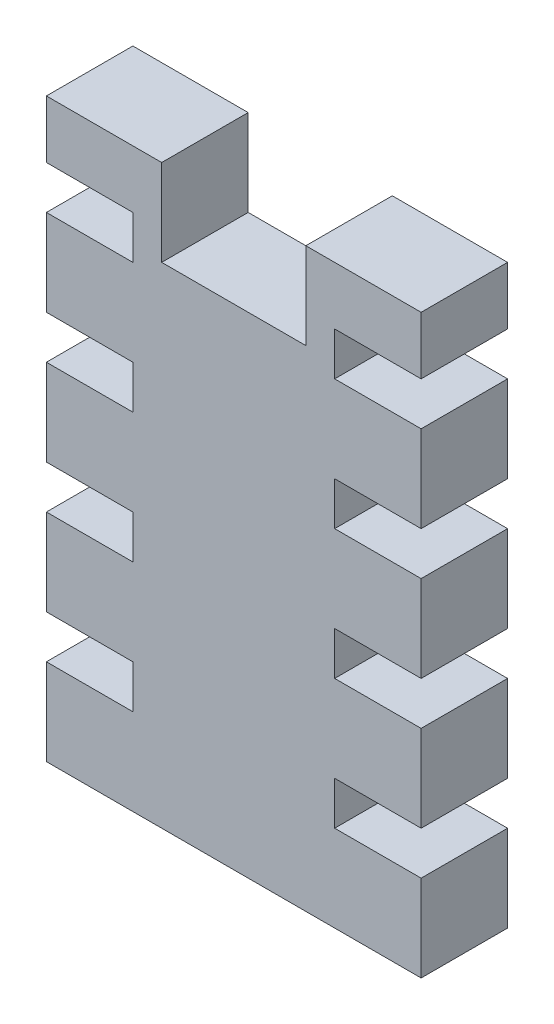
from build123d import *

# Parameters (mm, degrees)
SKETCH1_W           = 13
SKETCH1_H           = 20
BOSS_EXTRUDE1_DEPTH = 3
SKETCH2_W           = 3
SKETCH2_H           = 1.5
CUT_EXTRUDE1_DEPTH  = 3
SKETCH3_W           = 3
SKETCH3_H           = 1.5
CUT_EXTRUDE2_DEPTH  = 3
SKETCH5_W           = 5
SKETCH5_H           = 3
CUT_EXTRUDE6_DEPTH  = 3
SKETCH6_W           = 3
SKETCH6_H           = 1.5
CUT_EXTRUDE7_DEPTH  = 10


with BuildPart() as part:
    # Sketch1 → Boss-Extrude1 (new body)
    with BuildSketch(Plane.XY):
        with Locations((0, 4.633458647)):
            Rectangle(SKETCH1_W, SKETCH1_H)
    extrude(amount=BOSS_EXTRUDE1_DEPTH)

    # Sketch2 → Cut-Extrude1 (cut)
    with BuildSketch(Plane.XY.offset(3)):
        with Locations((-5, 11.883458647)):
            Rectangle(SKETCH2_W, SKETCH2_H)
        with Locations((-5, 7.383458647)):
            Rectangle(SKETCH2_W, SKETCH2_H)
    extrude(amount=-CUT_EXTRUDE1_DEPTH, mode=Mode.SUBTRACT)

    # Sketch3 → Cut-Extrude2 (cut)
    with BuildSketch(Plane.XY.offset(3)):
        with Locations((5, 11.883458647)):
            Rectangle(SKETCH3_W, SKETCH3_H)
        with Locations((5, 7.383458647)):
            Rectangle(SKETCH3_W, SKETCH3_H)
    extrude(amount=-CUT_EXTRUDE2_DEPTH, mode=Mode.SUBTRACT)

    # Sketch5 → Cut-Extrude6 (cut)
    with BuildSketch(Plane.XY.offset(3)):
        with Locations((0, 13.133458647)):
            Rectangle(SKETCH5_W, SKETCH5_H)
    extrude(amount=-CUT_EXTRUDE6_DEPTH, mode=Mode.SUBTRACT)

    # Sketch6 → Cut-Extrude7 (cut)
    with BuildSketch(Plane.XY.offset(3)):
        with Locations((-5, 2.883458647)):
            Rectangle(SKETCH6_W, SKETCH6_H)
        with Locations((-5, -1.616541353)):
            Rectangle(SKETCH6_W, SKETCH6_H)
        with Locations((5, 2.883458647)):
            Rectangle(SKETCH6_W, SKETCH6_H)
        with Locations((5, -1.616541353)):
            Rectangle(SKETCH6_W, SKETCH6_H)
    extrude(amount=-CUT_EXTRUDE7_DEPTH, mode=Mode.SUBTRACT)


solid = part.part
